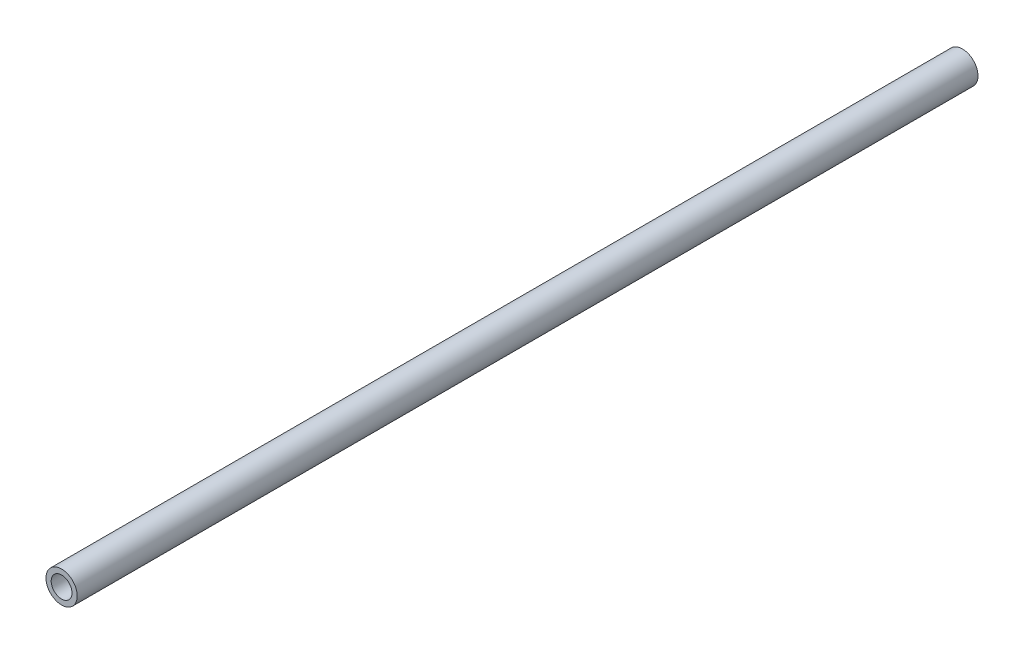
from build123d import *

# Parameters (mm, degrees)
SCHIZZO1_R                   = 3
SCHIZZO1_R_2                 = 2
ESTRUSIONE_ESTRUSIONE1_DEPTH = 173


with BuildPart() as part:
    # Schizzo1 → Estrusione-Estrusione1 (new body)
    with BuildSketch(Plane.XY):
        Circle(SCHIZZO1_R)
        Circle(SCHIZZO1_R_2, mode=Mode.SUBTRACT)
    extrude(amount=ESTRUSIONE_ESTRUSIONE1_DEPTH)


solid = part.part
